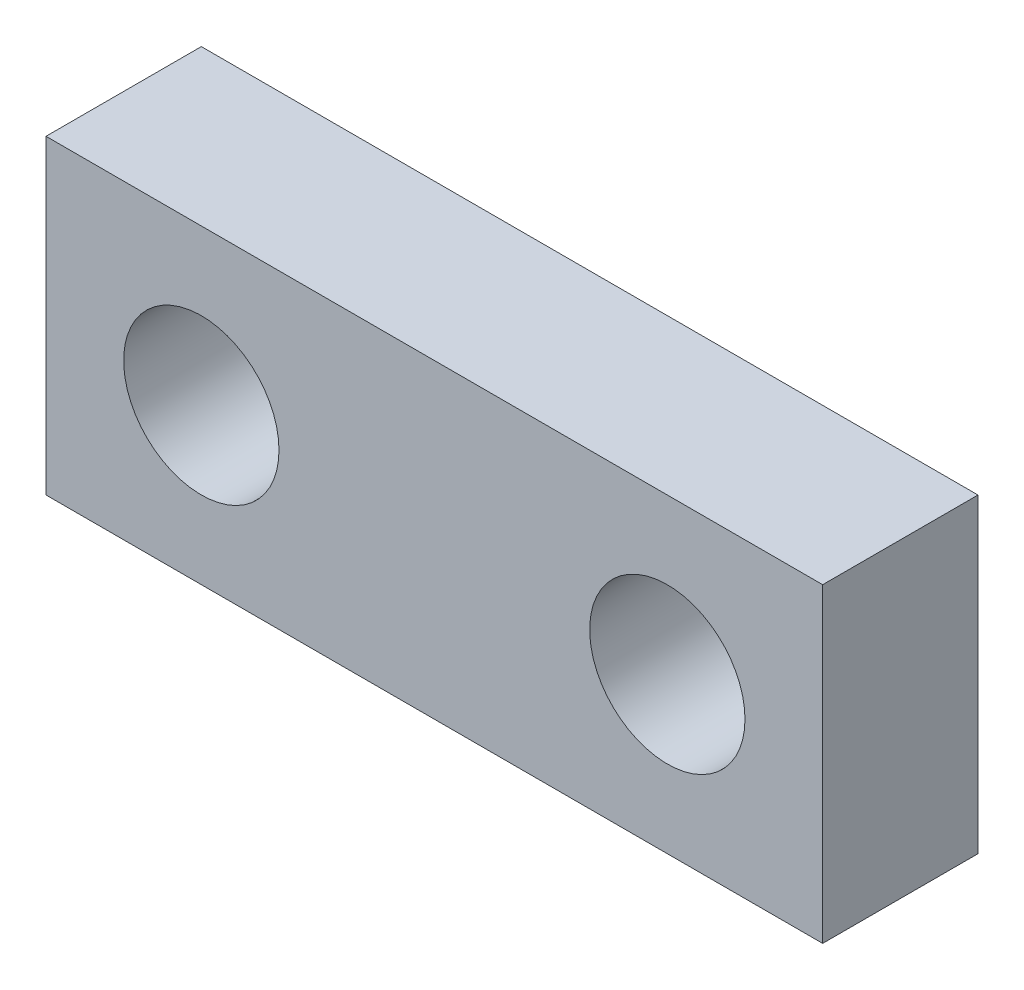
from build123d import *

# Parameters (mm, degrees)
SKETCH1_W           = 25
SKETCH1_H           = 10
SKETCH1_R           = 2.5
BOSS_EXTRUDE1_DEPTH = 5


with BuildPart() as part:
    # Sketch1 → Boss-Extrude1 (new body)
    with BuildSketch(Plane.XY):
        with Locations((-12.5, 5)):
            Rectangle(SKETCH1_W, SKETCH1_H)
        with Locations((-20, 5)):
            Circle(SKETCH1_R, mode=Mode.SUBTRACT)
        with Locations((-5, 5)):
            Circle(SKETCH1_R, mode=Mode.SUBTRACT)
    extrude(amount=BOSS_EXTRUDE1_DEPTH)


solid = part.part
